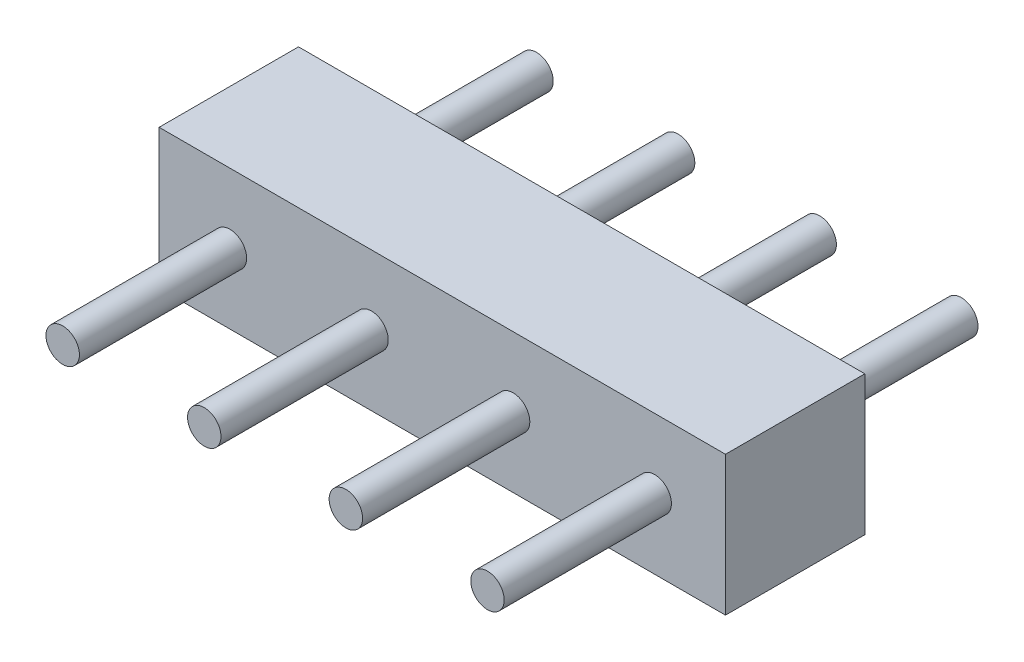
from build123d import *

# Parameters (mm, degrees)
SKETCH_1_W                 = 10.16
SKETCH_1_H                 = 2.5
EXTRUDE_1_DEPTH            = 2.5
EXTRUDE_START              = -5.5
SKETCH_2_R                 = 0.3
EXTRUDE_2_DEPTH            = 8.5
PATTERN_LINEAR_1_COUNT     = 3
PATTERN_LINEAR_1_PITCH     = 2.54
PATTERN_LINEAR_1_COL_COUNT = 2
PATTERN_LINEAR_1_COL_PITCH = 2.54


with BuildPart() as part:
    # 草图1 → 凸台-拉伸1 (new body)
    with BuildSketch(Plane.XY):
        with Locations((5.08, 1.25)):
            Rectangle(SKETCH_1_W, SKETCH_1_H)
    extrude(amount=EXTRUDE_1_DEPTH)

    # 草图2 → 凸台-拉伸2 (add)
    with BuildSketch(Plane.XY.offset(2.5).offset(EXTRUDE_START)):
        with Locations((3.81, 1.25)):
            Circle(SKETCH_2_R)
    extrude_2 = extrude(amount=EXTRUDE_2_DEPTH)

    # 阵列(线性)1: 凸台-拉伸2 ×3
    with Locations(*[(i * PATTERN_LINEAR_1_PITCH, 0, 0) for i in range(1, PATTERN_LINEAR_1_COUNT)]):
        add(extrude_2)

    # 阵列(线性)1 col: 凸台-拉伸2 ×2
    with Locations(*[(-i * PATTERN_LINEAR_1_COL_PITCH, 0, 0) for i in range(1, PATTERN_LINEAR_1_COL_COUNT)]):
        add(extrude_2)


solid = part.part
